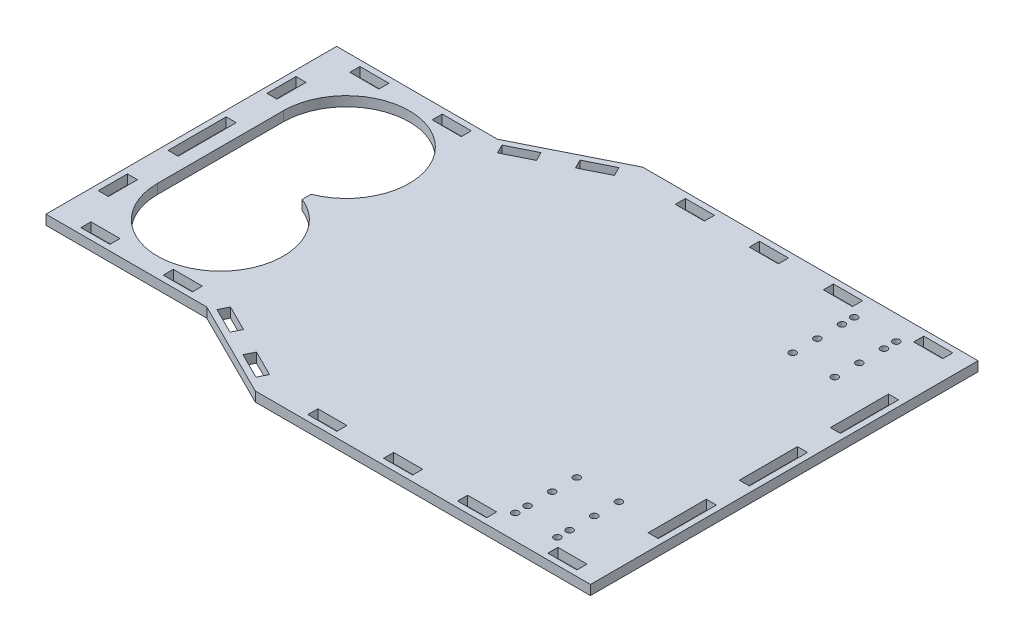
from build123d import *

# Parameters (mm, degrees)
SKETCH1_R           = 1.75
SKETCH1_W           = 15
SKETCH1_H           = 5.2
SKETCH1_W_2         = 5.2
SKETCH1_H_2         = 30
SKETCH1_H_3         = 15
BOSS_EXTRUDE1_DEPTH = 5


with BuildPart() as part:
    # Sketch1 → Boss-Extrude1 (new body)
    with BuildSketch(Plane(origin=(0, 0, 0), x_dir=(1, 0, 0), z_dir=(0, 1, 0))):
        Polygon((92.514530464, -147.019914311), (92.514530464, 52.980085689), (-80.485469536, 52.980085689), (-130.485469536, 27.980085689), (-213.485469536, 27.980085689), (-213.485469536, -122.019914311), (-130.485469536, -122.019914311), (-80.485469536, -147.019914311), align=None)
        with Locations(Location((62.864530464, -134.489914311, 0), (0, 0, 270))):
            Circle(SKETCH1_R, mode=Mode.SUBTRACT)
        with Locations(Location((41.164530464, -134.489914311, 0), (0, 0, 270))):
            Circle(SKETCH1_R, mode=Mode.SUBTRACT)
        with Locations(Location((62.864530464, -128.139914311, 0), (0, 0, 270))):
            Circle(SKETCH1_R, mode=Mode.SUBTRACT)
        with Locations(Location((41.164530464, -128.139914311, 0), (0, 0, 270))):
            Circle(SKETCH1_R, mode=Mode.SUBTRACT)
        with Locations(Location((62.864530464, -115.439914311, 0), (0, 0, 270))):
            Circle(SKETCH1_R, mode=Mode.SUBTRACT)
        with Locations(Location((41.164530464, -115.439914311, 0), (0, 0, 270))):
            Circle(SKETCH1_R, mode=Mode.SUBTRACT)
        with Locations(Location((62.864530464, -102.739914311, 0), (0, 0, 270))):
            Circle(SKETCH1_R, mode=Mode.SUBTRACT)
        with Locations(Location((41.164530464, -102.739914311, 0), (0, 0, 270))):
            Circle(SKETCH1_R, mode=Mode.SUBTRACT)
        with Locations(Location((41.164530464, 8.700085689, 0), (0, 0, 90))):
            Circle(SKETCH1_R, mode=Mode.SUBTRACT)
        with Locations(Location((41.164530464, 21.400085689, 0), (0, 0, 90))):
            Circle(SKETCH1_R, mode=Mode.SUBTRACT)
        with Locations(Location((41.164530464, 34.100085689, 0), (0, 0, 90))):
            Circle(SKETCH1_R, mode=Mode.SUBTRACT)
        with Locations(Location((41.164530464, 40.450085689, 0), (0, 0, 90))):
            Circle(SKETCH1_R, mode=Mode.SUBTRACT)
        with Locations(Location((62.864530464, 8.700085689, 0), (0, 0, 90))):
            Circle(SKETCH1_R, mode=Mode.SUBTRACT)
        with Locations(Location((62.864530464, 21.400085689, 0), (0, 0, 90))):
            Circle(SKETCH1_R, mode=Mode.SUBTRACT)
        with Locations(Location((62.864530464, 34.100085689, 0), (0, 0, 90))):
            Circle(SKETCH1_R, mode=Mode.SUBTRACT)
        with Locations(Location((62.864530464, 40.450085689, 0), (0, 0, 90))):
            Circle(SKETCH1_R, mode=Mode.SUBTRACT)
        with Locations((75.014530464, 47.380085689)):
            Rectangle(SKETCH1_W, SKETCH1_H, mode=Mode.SUBTRACT)
        with Locations((75.014530464, -141.419914311)):
            Rectangle(SKETCH1_W, SKETCH1_H, mode=Mode.SUBTRACT)
        with Locations((86.914530464, -0.019914311)):
            Rectangle(SKETCH1_W_2, SKETCH1_H_2, mode=Mode.SUBTRACT)
        with Locations((86.914530464, -47.019914311)):
            Rectangle(SKETCH1_W_2, SKETCH1_H_2, mode=Mode.SUBTRACT)
        with Locations((86.914530464, -94.019914311)):
            Rectangle(SKETCH1_W_2, SKETCH1_H_2, mode=Mode.SUBTRACT)
        with Locations((-9.785469536, 47.373767599)):
            Rectangle(SKETCH1_W, SKETCH1_H, mode=Mode.SUBTRACT)
        with Locations((-47.985469536, 47.373767599)):
            Rectangle(SKETCH1_W, SKETCH1_H, mode=Mode.SUBTRACT)
        with Locations((-148.485469536, 22.380085689)):
            Rectangle(SKETCH1_W, SKETCH1_H, mode=Mode.SUBTRACT)
        with Locations((-190.985469536, 22.380085689)):
            Rectangle(SKETCH1_W, SKETCH1_H, mode=Mode.SUBTRACT)
        with Locations((-207.885469536, -3.519914311)):
            Rectangle(SKETCH1_W_2, SKETCH1_H_3, mode=Mode.SUBTRACT)
        with Locations((-207.885469536, -47.019914311)):
            Rectangle(SKETCH1_W_2, SKETCH1_H_2, mode=Mode.SUBTRACT)
        with Locations((-207.885469536, -90.519914311)):
            Rectangle(SKETCH1_W_2, SKETCH1_H_3, mode=Mode.SUBTRACT)
        with Locations((-48.86060515, -141.420106162)):
            Rectangle(SKETCH1_W, SKETCH1_H, mode=Mode.SUBTRACT)
        with Locations((-148.485469536, -116.419914311)):
            Rectangle(SKETCH1_W, SKETCH1_H, mode=Mode.SUBTRACT)
        with Locations((-190.985469536, -116.419914311)):
            Rectangle(SKETCH1_W, SKETCH1_H, mode=Mode.SUBTRACT)
        with Locations((28.414530464, 47.380085689)):
            Rectangle(SKETCH1_W, SKETCH1_H, mode=Mode.SUBTRACT)
        with BuildLine():
            Line((-153.985469536, -47.019914311), (-153.985469536, -44.723390932))
            ThreePointArc((-153.985469536, -44.723390932), (-147.733757287, 12.371069308), (-198.485469536, -14.519914311))
            Line((-198.485469536, -14.519914311), (-198.485469536, -79.519914311))
            ThreePointArc((-198.485469536, -79.519914311), (-147.733757287, -106.41089793), (-153.985469536, -49.31643769))
            Line((-153.985469536, -49.31643769), (-153.985469536, -47.019914311))
        make_face(mode=Mode.SUBTRACT)
        with Locations((28.414530464, -141.419914311)):
            Rectangle(SKETCH1_W, SKETCH1_H, mode=Mode.SUBTRACT)
        with Locations((-9.785469536, -141.413596222)):
            Rectangle(SKETCH1_W, SKETCH1_H, mode=Mode.SUBTRACT)
        Polygon((-110.963133782, 28.573374858), (-113.288285266, 33.223677824), (-126.704693131, 26.515473891), (-124.379541647, 21.865170925), align=None, mode=Mode.SUBTRACT)
        Polygon((-86.455469536, 46.640085689), (-84.130318052, 41.989782723), (-97.546725917, 35.28157879), (-99.871877401, 39.931881756), align=None, mode=Mode.SUBTRACT)
        Polygon((-99.871877401, -133.971710379), (-86.455469536, -140.679914311), (-84.130318052, -136.029611345), (-97.546725917, -129.321407413), align=None, mode=Mode.SUBTRACT)
        Polygon((-124.379541647, -115.904999548), (-110.963133782, -122.61320348), (-113.288285266, -127.263506446), (-126.704693131, -120.555302514), align=None, mode=Mode.SUBTRACT)
    extrude(amount=BOSS_EXTRUDE1_DEPTH)


solid = part.part
